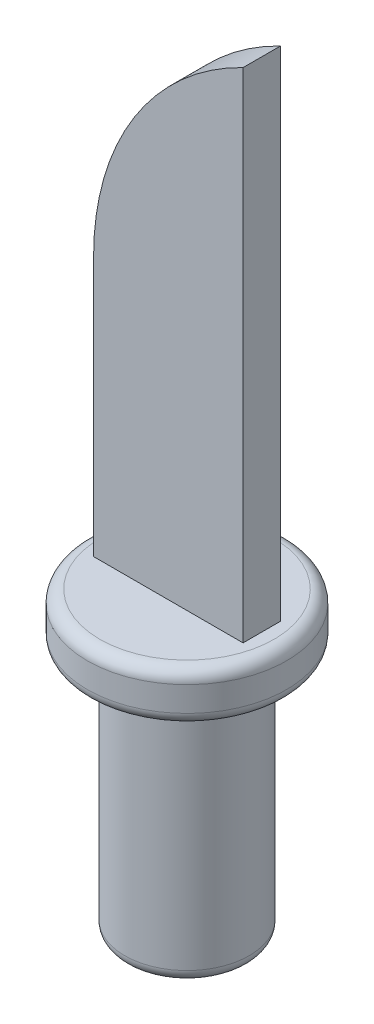
from build123d import *

# Parameters (mm, degrees)
SWEEP_1_PROFILE_R   = 25
SKETCH_9_R          = 40
EXTRUDE_2_DEPTH     = 20
FILLET_1_R          = 5
SKETCH_11_W         = 60
SKETCH_11_H         = 15
EXTRUDE_3_DEPTH     = 200
CUT_EXTRUDE_1_DEPTH = 326.969707196
SCALE_1_SCALE       = 0.05


with BuildPart() as part:
    # 扫描1: sweep along a path in 草图1
    with BuildLine(Plane.XY) as sweep_1_path:
        Line((0, 0), (0, 100))
    # 扫描1 profile (on start of the path) → 扫描1 (sweep)
    with BuildSketch(Plane.ZX):
        Circle(SWEEP_1_PROFILE_R)
    sweep(path=sweep_1_path.line)

    # 草图9 → 凸台-拉伸2 (add)
    with BuildSketch(Plane(origin=(0, 100, 0), x_dir=(1, 0, 0), z_dir=(0, 1, 0))):
        with Locations(Location((0, 0, 0), (0, 0, 270))):
            Circle(SKETCH_9_R)
    extrude(amount=EXTRUDE_2_DEPTH)

    # 圆角1
    fillet_1_edges = [part.edges().sort_by_distance(p)[0] for p in [
        (0, 0, -25),
        (0, 100, -40),
        (0, 120, -40),
    ]]
    fillet(fillet_1_edges, radius=FILLET_1_R)

    # 草图11 → 凸台-拉伸3 (add)
    with BuildSketch(Plane(origin=(0, 120, 0), x_dir=(1, 0, 0), z_dir=(0, 1, 0))):
        Rectangle(SKETCH_11_W, SKETCH_11_H)
    extrude(amount=EXTRUDE_3_DEPTH)

    # 草图12 → 切除-拉伸1 (cut, through all)
    with BuildSketch(Plane.XY.offset(7.5)):
        with BuildLine():
            Line((-30, 224.261621757), (-30, 320))
            Line((-30, 320), (30, 320))
            ThreePointArc((30, 320), (-13.760497544, 280.754623688), (-30, 224.261621757))
        make_face()
    extrude(amount=-CUT_EXTRUDE_1_DEPTH, mode=Mode.SUBTRACT)


with BuildPart() as part_1:
    # 缩放比例1: scaled about (0.729315594, 117.844803008, 0)
    add(part.part.scale(SCALE_1_SCALE).moved(Location((0.692849814, 111.952562858, 0))))


solid = part_1.part
